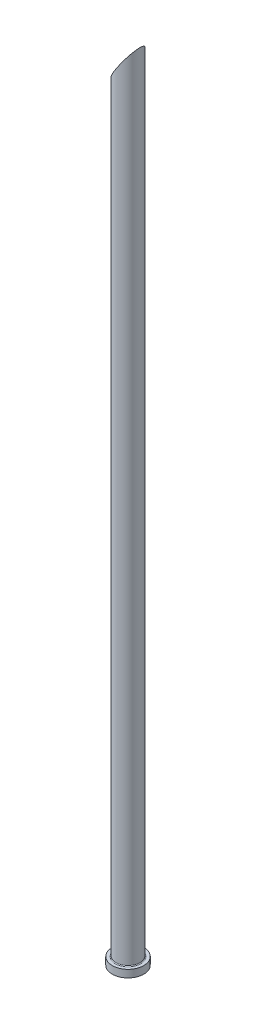
from build123d import *

# Parameters (mm, degrees)
SKETCH1_W               = 0.127
SKETCH1_H               = 27.075340428
CUT_EXTRUDE1_DEPTH      = 56.490859014
CUT_EXTRUDE1_DEPTH_BACK = 56.490859014
EXTRUDE1_START          = 0.254
SKETCH3_R               = 0.5334
SKETCH3_R_2             = 0.2794
EXTRUDE1_DEPTH          = 0.254
FILLET1_R               = 0.0254


with BuildPart() as part:
    # Sketch1 → Revolve-Thin1 (revolve)
    with BuildSketch(Plane.XY, mode=Mode.PRIVATE) as revolve_thin1_sk:
        with Locations((-0.3429, 41.950212357)):
            Rectangle(SKETCH1_W, SKETCH1_H)
    revolve(revolve_thin1_sk.sketch.rotate(Axis((0, 30.869098032, 0), (0, 1, 0)), 270), axis=Axis((0, 30.869098032, 0), (0, 1, 0)))

    # Sketch2 → Cut-Extrude1 (cut, two sides: drawn at the far end of the back side and taken through both)
    with BuildSketch(Plane.XY.offset(-CUT_EXTRUDE1_DEPTH_BACK)):
        Polygon((-39.853008345, -6.512099504), (-2.911484943, 50.188843392), (1.641018786, 57.176407255), (38.582542188, 113.877350151), (-74.819343604, 187.760396955), (-153.254894137, 67.3709473), align=None)
    extrude(amount=CUT_EXTRUDE1_DEPTH + CUT_EXTRUDE1_DEPTH_BACK, mode=Mode.SUBTRACT)

    # Sketch3 → Extrude1 (add)
    with BuildSketch(Plane.XZ.offset(-28.412542143).offset(EXTRUDE1_START)):
        with Locations(Location((0, 0, 0), (0, 0, 270))):
            Circle(SKETCH3_R)
        with Locations(Location((0, 0, 0), (0, 0, 270))):
            Circle(SKETCH3_R_2, mode=Mode.SUBTRACT)
    extrude(amount=-EXTRUDE1_DEPTH)

    # Fillet1
    fillet1_edges = [part.edges().sort_by_distance(p)[0] for p in [
        (0, 28.412542143, 0.4064),
    ]]
    fillet(fillet1_edges, radius=FILLET1_R)


solid = part.part
